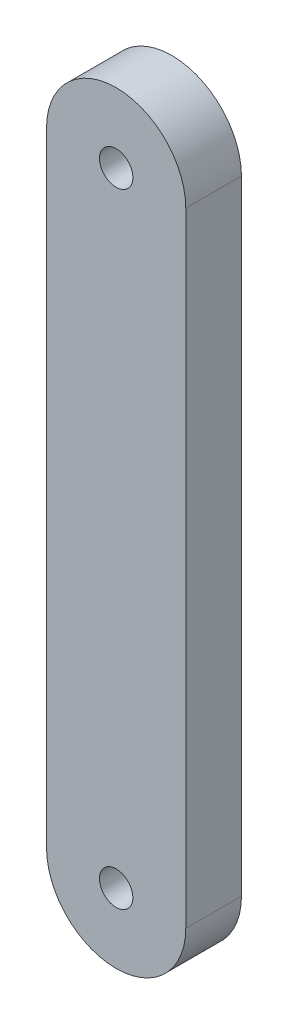
from build123d import *

# Parameters (mm, degrees)
SKETCH1_R           = 3
BOSS_EXTRUDE1_DEPTH = 10


with BuildPart() as part:
    # Sketch1 → Boss-Extrude1 (new body)
    with BuildSketch(Plane.XY):
        with BuildLine():
            Line((-12.5, 0), (-12.5, -112))
            ThreePointArc((-12.5, -112), (0, -124.5), (12.5, -112))
            Line((12.5, -112), (12.5, 0))
            ThreePointArc((12.5, 0), (0, 12.5), (-12.5, 0))
        make_face()
        Circle(SKETCH1_R, mode=Mode.SUBTRACT)
        with Locations(Location((0, -112, 0), (0, 0, 180))):
            Circle(SKETCH1_R, mode=Mode.SUBTRACT)
    extrude(amount=BOSS_EXTRUDE1_DEPTH)


solid = part.part
